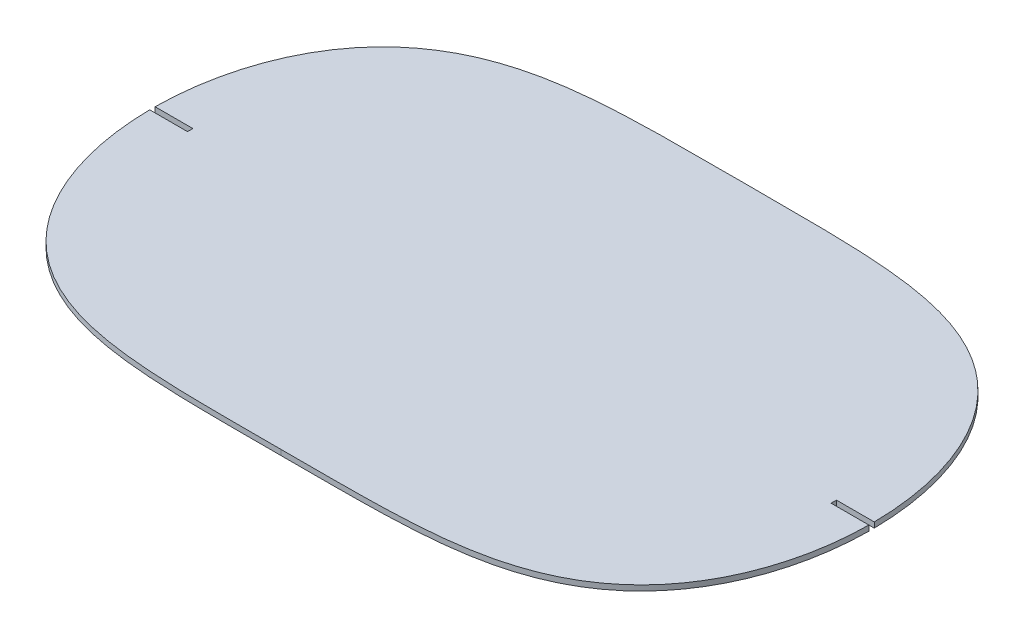
from build123d import *

# Parameters (mm, degrees)
BOSS_EXTRUDE2_DEPTH = 3
SKETCH4_W           = 23.944295053
SKETCH4_H           = 3
CUT_EXTRUDE2_DEPTH  = 98
SKETCH5_W           = 27.333105753
SKETCH5_H           = 3
CUT_EXTRUDE3_DEPTH  = 39


with BuildPart() as part:
    # Sketch1 → Boss-Extrude2 (new body)
    with BuildSketch(Plane(origin=(0, 0, 0), x_dir=(1, 0, 0), z_dir=(0, 1, 0))):
        with BuildLine():
            add(Edge.make_bspline(
                [(0, 129.099444874), (4.329825716, 129.099856757), (12.989477034, 129.099521717), (25.976301205, 129.099245615), (43.290249676, 129.013980379), (60.600663959, 128.671189087), (77.894655735, 127.812916551), (95.543037977, 126.045988358), (113.01399335, 122.896019952), (130.046357946, 117.797143556), (146.158139311, 110.226946457), (160.431314667, 100.265018203), (172.693338202, 87.911885541), (182.663351285, 73.663423027), (190.340438043, 58.079107996), (195.865426103, 41.62272021), (199.400795759, 24.636185909), (201.069948812, 7.370686111), (200.935166589, -9.973525735), (198.991239132, -27.210718658), (195.166319776, -44.135428769), (189.328734448, -60.48538478), (181.314677982, -75.901802403), (170.994375318, -89.90233662), (157.866189481, -102.437720294), (141.967900724, -112.68294779), (124.642016349, -119.756709815), (106.708377896, -124.219228333), (88.446200884, -126.903428265), (70.051310284, -128.322663007), (45.62975056, -129.099776243), (25.349069661, -129.099346893), (10.139933531, -129.099445048), (-2.223e-06, -129.099444874)],
                knots=[0, 0, 0, 0, 0, 0.03122023, 0.062440461, 0.093641547, 0.124842633, 0.156052703, 0.187262773, 0.221451125, 0.252661674, 0.283871788, 0.315081907, 0.34629216, 0.377502474, 0.408712793, 0.439923128, 0.471133499, 0.502343874, 0.533554233, 0.564764591, 0.595974957, 0.627185296, 0.658395569, 0.689605838, 0.720816286, 0.757370802, 0.793925658, 0.823852077, 0.853778496, 0.890332223, 0.92688595, 1, 1, 1, 1, 1], degree=4))
            add(Edge.make_bspline(
                [(0, 129.099444874), (-4.329825716, 129.099856832), (-12.989477034, 129.099521941), (-25.976301205, 129.099246062), (-43.290249678, 129.013981124), (-60.600663967, 128.67119013), (-77.894655757, 127.812917893), (-95.543038029, 126.045990003), (-113.013993457, 122.896021898), (-130.04635814, 117.797145795), (-146.158139636, 110.226948973), (-160.431315164, 100.265020966), (-172.693338911, 87.911888514), (-182.663352239, 73.663426172), (-190.340439266, 58.079111273), (-195.865427609, 41.622723582), (-199.400797558, 24.636189342), (-201.069950908, 7.370689573), (-200.935168983, -9.973522276), (-198.991241823, -27.210715232), (-195.166322759, -44.135425409), (-189.328737713, -60.48538152), (-181.314681512, -75.901799281), (-170.994379089, -89.902333676), (-157.866193468, -102.437717576), (-141.967904887, -112.682945345), (-124.642020634, -119.756707669), (-106.708382258, -124.219226496), (-88.446205291, -126.903426743), (-70.051314717, -128.322661801), (-45.629755005, -129.099775457), (-25.349074106, -129.099346457), (-10.139937977, -129.099444874), (-2.223e-06, -129.099444874)],
                knots=[0, 0, 0, 0, 0, 0.03122023, 0.062440461, 0.093641547, 0.124842633, 0.156052703, 0.187262773, 0.221451125, 0.252661674, 0.283871788, 0.315081907, 0.34629216, 0.377502474, 0.408712793, 0.439923128, 0.471133499, 0.502343874, 0.533554233, 0.564764591, 0.595974957, 0.627185296, 0.658395569, 0.689605838, 0.720816286, 0.757370802, 0.793925658, 0.823852077, 0.853778496, 0.890332223, 0.92688595, 1, 1, 1, 1, 1], degree=4))
        make_face()
    extrude(amount=BOSS_EXTRUDE2_DEPTH)

    # Sketch4 → Cut-Extrude2 (cut)
    with BuildSketch(Plane(origin=(0, 0, 0), x_dir=(1, 0, 0), z_dir=(0, 1, 0))):
        with Locations((-191.702695575, 0)):
            Rectangle(SKETCH4_W, SKETCH4_H)
    extrude(amount=CUT_EXTRUDE2_DEPTH, mode=Mode.SUBTRACT)

    # Sketch5 → Cut-Extrude3 (cut)
    with BuildSketch(Plane(origin=(0, 0, 0), x_dir=(1, 0, 0), z_dir=(0, 1, 0))):
        with Locations((193.397098701, 0)):
            Rectangle(SKETCH5_W, SKETCH5_H)
    extrude(amount=CUT_EXTRUDE3_DEPTH, mode=Mode.SUBTRACT)


solid = part.part
